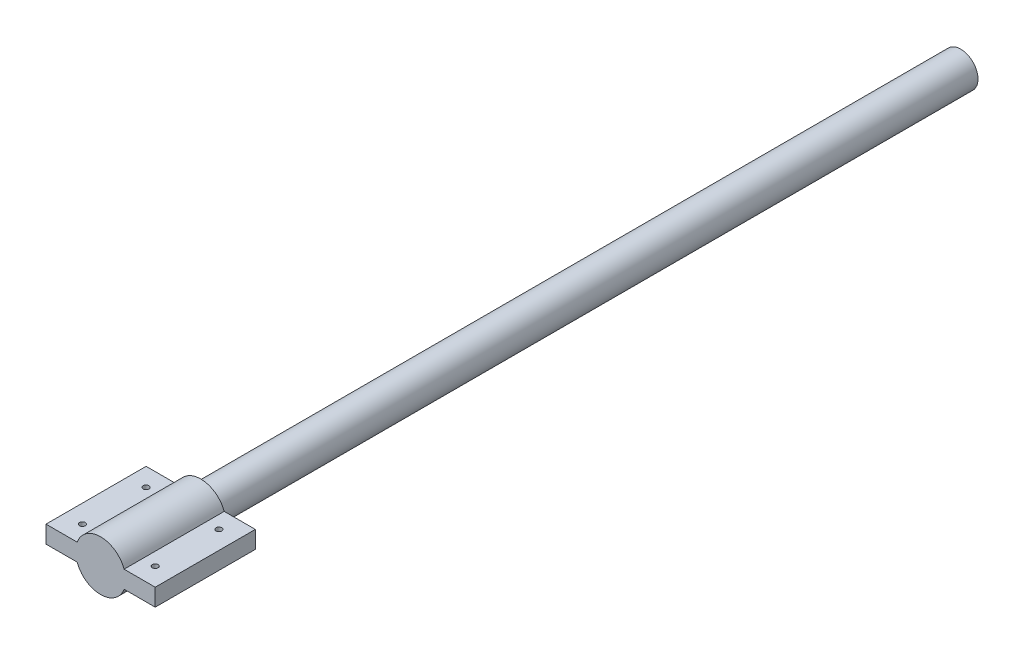
from build123d import *

# Parameters (mm, degrees)
SKETCH1_R           = 19
BOSS_EXTRUDE1_DEPTH = 945
BOSS_EXTRUDE2_START = -110
SKETCH2_R           = 19
BOSS_EXTRUDE2_DEPTH = 110
SKETCH3_R           = 3.175
CUT_EXTRUDE1_DEPTH  = 948.626429889


with BuildPart() as part:
    # Sketch1 → Boss-Extrude1 (new body)
    with BuildSketch(Plane.XY):
        Circle(SKETCH1_R)
    extrude(amount=BOSS_EXTRUDE1_DEPTH)

    # Sketch2 → Boss-Extrude2 (add)
    with BuildSketch(Plane.XY.offset(945).offset(BOSS_EXTRUDE2_START)):
        with BuildLine():
            Line((-60, -9.525), (-25.797759108, -9.525))
            ThreePointArc((-25.797759108, -9.525), (0, -27.5), (25.797759108, -9.525))
            Line((25.797759108, -9.525), (60, -9.525))
            Line((60, -9.525), (60, 9.525))
            Line((60, 9.525), (25.797759108, 9.525))
            ThreePointArc((25.797759108, 9.525), (0, 27.5), (-25.797759108, 9.525))
            Line((-25.797759108, 9.525), (-60, 9.525))
            Line((-60, 9.525), (-60, -9.525))
        make_face()
        Circle(SKETCH2_R, mode=Mode.SUBTRACT)
    extrude(amount=BOSS_EXTRUDE2_DEPTH)

    # Sketch3 → Cut-Extrude1 (cut, through all)
    with BuildSketch(Plane(origin=(0, 9.525, 0), x_dir=(1, 0, 0), z_dir=(0, 1, 0))):
        with Locations(Location((40, -925, 0), (0, 0, 180))):
            Circle(SKETCH3_R)
        with Locations(Location((40, -855, 0), (0, 0, 180))):
            Circle(SKETCH3_R)
        with Locations(Location((-40, -925, 0), (0, 0, 180))):
            Circle(SKETCH3_R)
        with Locations(Location((-40, -855, 0), (0, 0, 180))):
            Circle(SKETCH3_R)
    extrude(amount=-CUT_EXTRUDE1_DEPTH, mode=Mode.SUBTRACT)


solid = part.part
